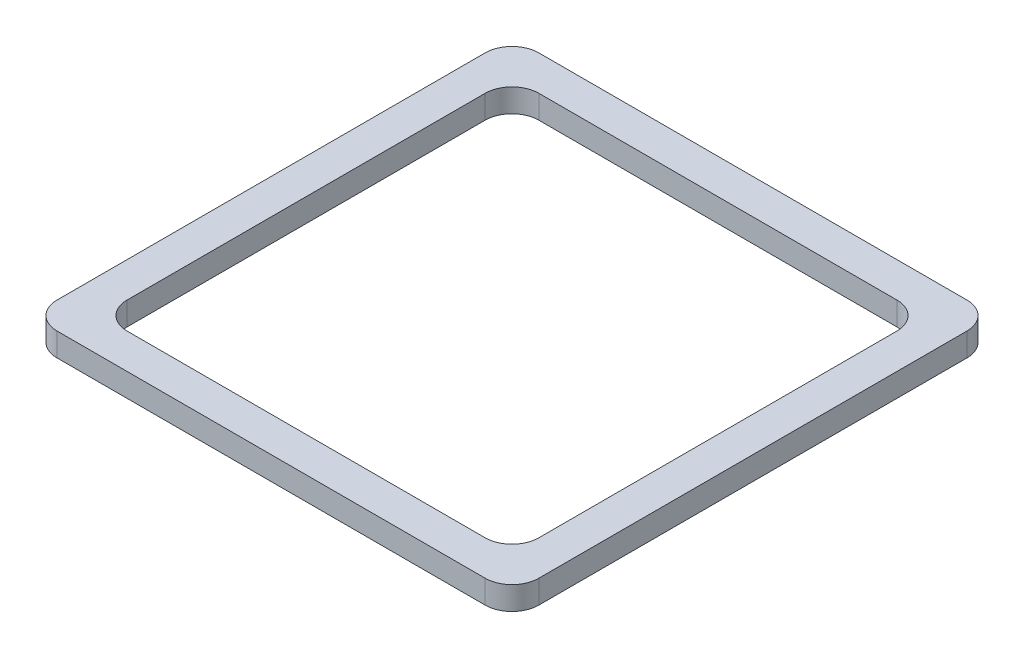
from build123d import *

# Parameters (mm, degrees)
SKETCH1_W           = 20.65
SKETCH1_H           = 20.65
BOSS_EXTRUDE1_DEPTH = 1
FILLET1_R           = 1.15


with BuildPart() as part:
    # Sketch1 → Boss-Extrude1 (new body)
    with BuildSketch(Plane(origin=(0, 0, 0), x_dir=(1, 0, 0), z_dir=(0, 1, 0))):
        Rectangle(SKETCH1_W, SKETCH1_H)
        with BuildLine():
            Line((7.675, -8.825), (-7.675, -8.825))
            ThreePointArc((-7.675, -8.825), (-8.488172798, -8.488172798), (-8.825, -7.675))
            Line((-8.825, -7.675), (-8.825, 7.675))
            ThreePointArc((-8.825, 7.675), (-8.488172798, 8.488172798), (-7.675, 8.825))
            Line((-7.675, 8.825), (7.675, 8.825))
            ThreePointArc((7.675, 8.825), (8.488172798, 8.488172798), (8.825, 7.675))
            Line((8.825, 7.675), (8.825, -7.675))
            ThreePointArc((8.825, -7.675), (8.488172798, -8.488172798), (7.675, -8.825))
        make_face(mode=Mode.SUBTRACT)
    extrude(amount=BOSS_EXTRUDE1_DEPTH)

    # Fillet1
    fillet1_edges = [part.edges().sort_by_distance(p)[0] for p in [
        (-10.325, 0.5, -10.325),
        (-10.325, 0.5, 10.325),
        (10.325, 0.5, 10.325),
        (10.325, 0.5, -10.325),
    ]]
    fillet(fillet1_edges, radius=FILLET1_R)


solid = part.part
